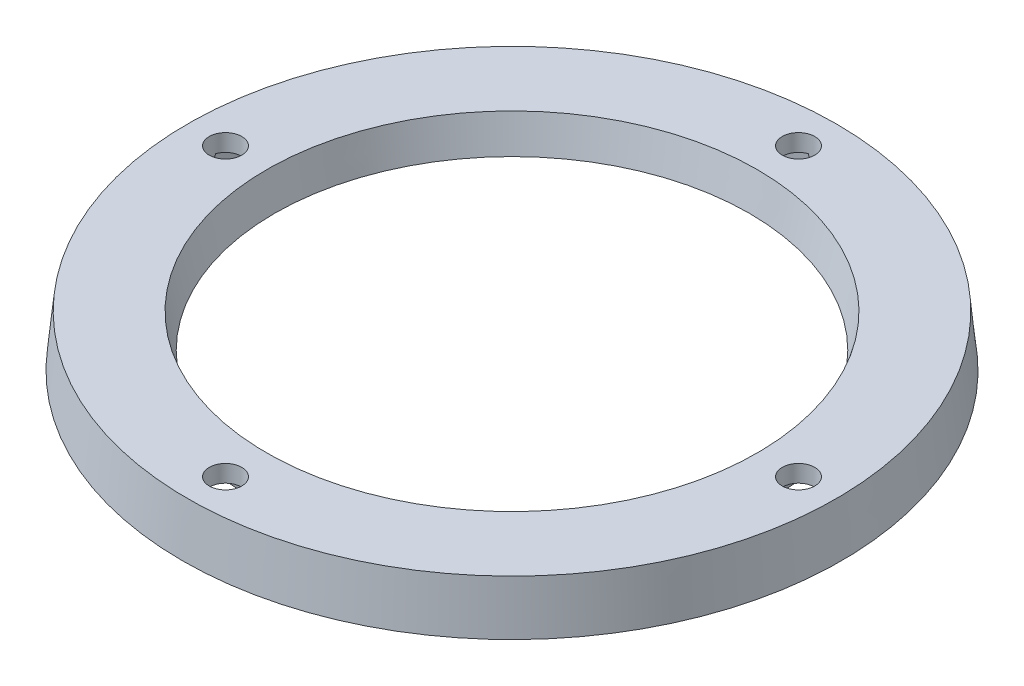
from build123d import *

# Parameters (mm, degrees)
CUT_EXTRUDE1_DEPTH      = 39.535734715
CUT_EXTRUDE1_DEPTH_BACK = 39.535734715
SKETCH2_R               = 1.335


with BuildPart() as part:
    # Sketch1 → Revolve1 (revolve)
    with BuildSketch(Plane(origin=(0, 0, 0), x_dir=(0, 0, -1), z_dir=(1, 0, 0)), mode=Mode.PRIVATE) as revolve1_sk:
        Polygon((-27.085, 0), (-26.665, 4.22), (-20.165, 4.22), (-19.515, 1.43), (-21.195, 1.43), (-21.516505376, 2.81), (-24.805331754, 2.81), (-25.085, 0), align=None)
    revolve(revolve1_sk.sketch.rotate(Axis((0, 0, 0), (0, 1, 0)), 180), axis=Axis((0, 0, 0), (0, 1, 0)))

    # Sketch2 → Cut-Extrude1 (cut, two sides: drawn at the far end of the back side and taken through both)
    with BuildSketch(Plane(origin=(0, 4.22, 0), x_dir=(1, 0, 0), z_dir=(0, 1, 0)).offset(-CUT_EXTRUDE1_DEPTH_BACK)):
        with Locations(Location((-23.546655814, 0, 0), (0, 0, 200.002165661))):
            Circle(SKETCH2_R)
        with Locations(Location((0, 23.546655814, 0), (0, 0, 90.000000013))):
            Circle(SKETCH2_R)
        with Locations(Location((23.546655814, 0, 0), (0, 0, 339.997832315))):
            Circle(SKETCH2_R)
        with Locations(Location((0, -23.546655814, 0), (0, 0, 290.002165661))):
            Circle(SKETCH2_R)
    extrude(amount=CUT_EXTRUDE1_DEPTH + CUT_EXTRUDE1_DEPTH_BACK, mode=Mode.SUBTRACT)


solid = part.part
